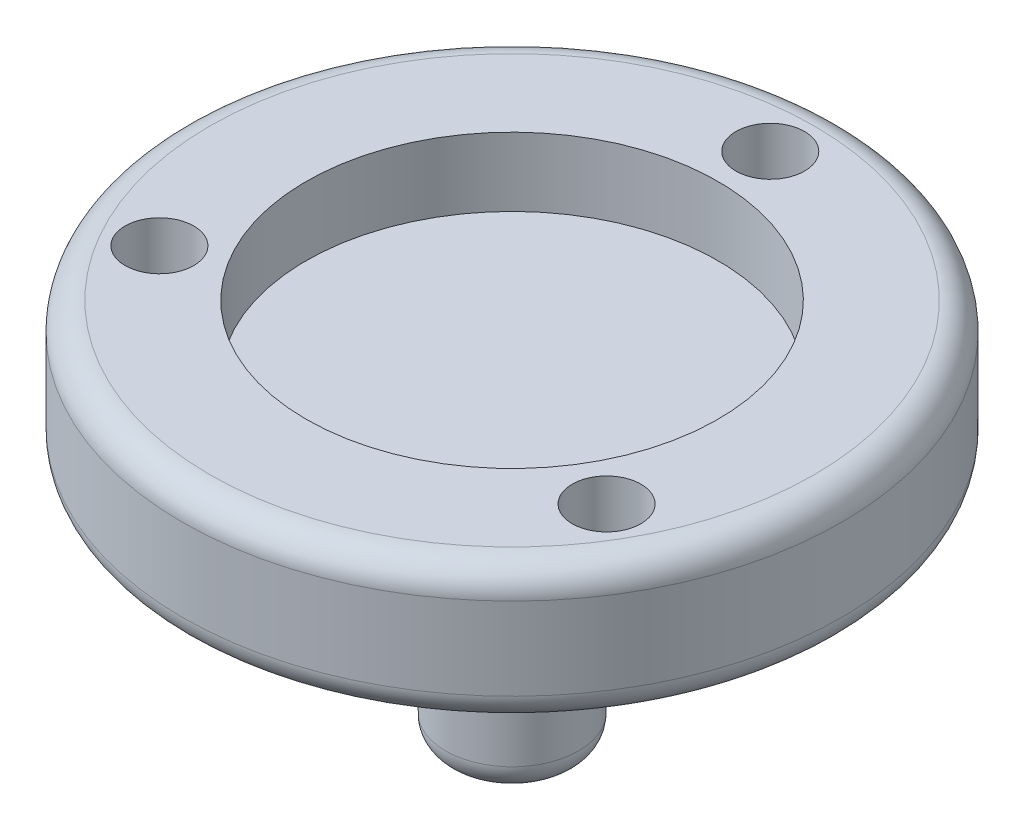
from build123d import *

# Parameters (mm, degrees)
SKETCH1_R           = 15.24
BOSS_EXTRUDE1_DEPTH = 6.35
SKETCH2_R           = 9.525
CUT_EXTRUDE1_DEPTH  = 3.175
FILLET4_R           = 1.27
SKETCH3_R           = 3.0734
BOSS_EXTRUDE3_DEPTH = 11.43
FILLET5_R           = 1.27
SKETCH4_R           = 1.5875
CUT_EXTRUDE2_DEPTH  = 2.54
CIRPATTERN1_COUNT   = 3


with BuildPart() as part:
    # Sketch1 → Boss-Extrude1 (new body)
    with BuildSketch(Plane(origin=(0, 0, 0), x_dir=(1, 0, 0), z_dir=(0, 1, 0))):
        Circle(SKETCH1_R)
    extrude(amount=BOSS_EXTRUDE1_DEPTH)

    # Sketch2 → Cut-Extrude1 (cut)
    with BuildSketch(Plane(origin=(0, 6.35, 0), x_dir=(1, 0, 0), z_dir=(0, 1, 0))):
        Circle(SKETCH2_R)
    extrude(amount=-CUT_EXTRUDE1_DEPTH, mode=Mode.SUBTRACT)

    # Fillet4
    fillet4_edges = [part.edges().sort_by_distance(p)[0] for p in [
        (-15.24, 6.35, 0),
    ]]
    fillet(fillet4_edges, radius=FILLET4_R)

    # Sketch3 → Boss-Extrude3 (add)
    with BuildSketch(Plane.XZ):
        Circle(SKETCH3_R)
    extrude(amount=BOSS_EXTRUDE3_DEPTH)

    # Fillet5
    fillet5_edges = [part.edges().sort_by_distance(p)[0] for p in [
        (-3.0734, -11.43, 0),
        (-15.24, 0, 0),
        (-3.0734, 0, 0),
    ]]
    fillet(fillet5_edges, radius=FILLET5_R)

    # Sketch4 → Cut-Extrude2 (cut)
    with BuildSketch(Plane(origin=(0, 6.35, 0), x_dir=(1, 0, 0), z_dir=(0, 1, 0))):
        with Locations((0, 11.938)):
            Circle(SKETCH4_R)
    cut_extrude2 = extrude(amount=-CUT_EXTRUDE2_DEPTH, mode=Mode.SUBTRACT)

    # CirPattern1: Cut-Extrude2 ×3 about axis
    cirpattern1_axis = Axis((0, 3.175, 0), (0, 1, 0))
    for i in range(1, CIRPATTERN1_COUNT):
        add(cut_extrude2.rotate(cirpattern1_axis, i * 360 / CIRPATTERN1_COUNT), mode=Mode.SUBTRACT)


solid = part.part
